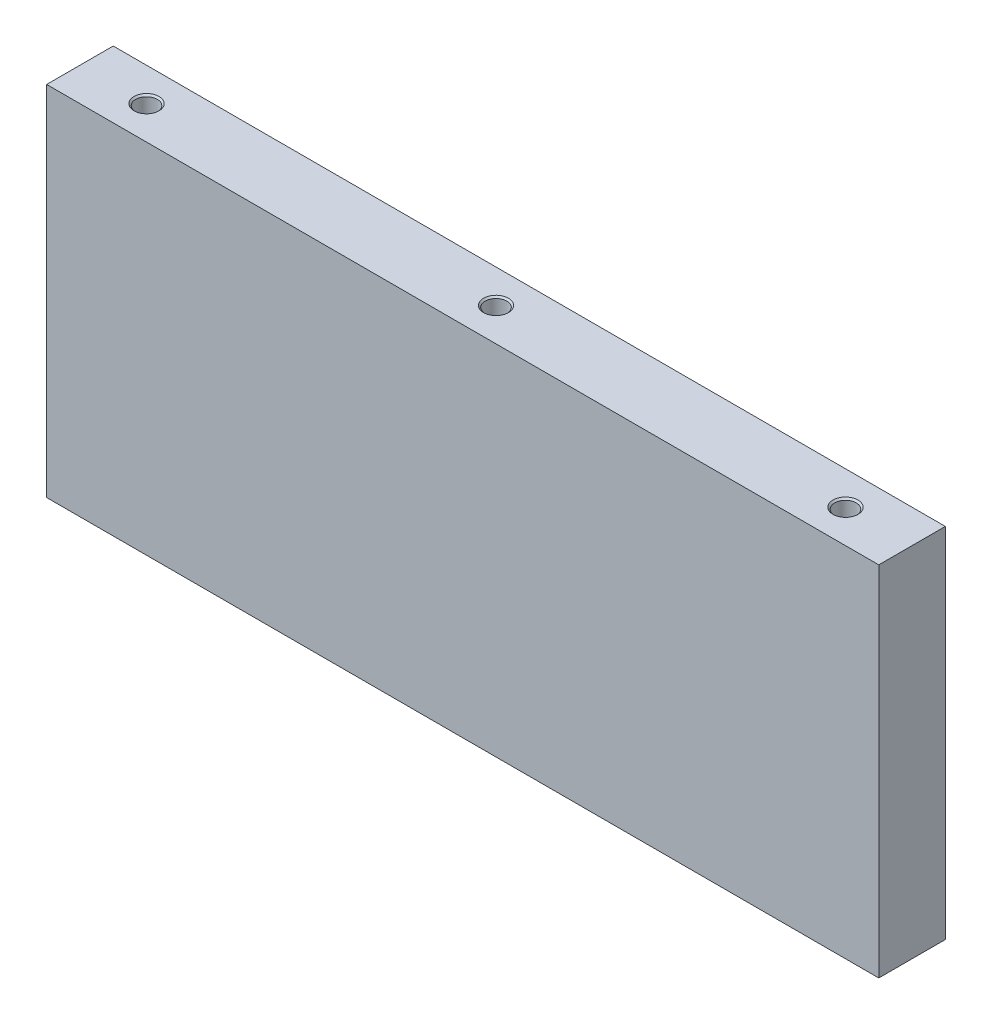
from build123d import *

# Parameters (mm, degrees)
SKETCH_1_W               = 100
SKETCH_1_H               = 43
EXTRUDE_1_DEPTH          = 8
SKETCH_2_R               = 1.3
CUT_EXTRUDE_1_DEPTH      = 8
PATTERN_LINEAR_1_COUNT   = 3
PATTERN_LINEAR_1_PITCH   = 42
MIRROR_1_COPY_1_SKETCH_R = 1.3
MIRROR_1_COPY_1_DEPTH    = 8
MIRROR_1_COPY_2_SKETCH_R = 1.3
MIRROR_1_COPY_2_DEPTH    = 8
CHAMFER_1_SIZE           = 0.2


with BuildPart() as part:
    # 草圖1 → 填料-伸長1 (new body)
    with BuildSketch(Plane.XY):
        Rectangle(SKETCH_1_W, SKETCH_1_H)
    extrude(amount=EXTRUDE_1_DEPTH)

    # 草圖2 → 除料-伸長1 (cut)
    with BuildSketch(Plane(origin=(0, 21.5, 0), x_dir=(1, 0, 0), z_dir=(0, 1, 0))):
        with Locations(Location((-42, -4, 0), (0, 0, 270))):
            Circle(SKETCH_2_R)
    cut_extrude_1 = extrude(amount=-CUT_EXTRUDE_1_DEPTH, mode=Mode.SUBTRACT)

    # 直線複製排列1: 除料-伸長1 ×3
    with Locations(*[(i * PATTERN_LINEAR_1_PITCH, 0, 0) for i in range(1, PATTERN_LINEAR_1_COUNT)]):
        add(cut_extrude_1, mode=Mode.SUBTRACT)

    # 鏡射1: 除料-伸長1 across plane
    add(cut_extrude_1.mirror(Plane.ZX), mode=Mode.SUBTRACT)

    # 鏡射1 copy 1 sketch → 鏡射1 copy 1 (cut)
    with BuildSketch(Plane(origin=(42, -21.5, 0), x_dir=(1, 0, 0), z_dir=(0, -1, 0))):
        with Locations((-42, 4)):
            Circle(MIRROR_1_COPY_1_SKETCH_R)
    extrude(amount=-MIRROR_1_COPY_1_DEPTH, mode=Mode.SUBTRACT)

    # 鏡射1 copy 2 sketch → 鏡射1 copy 2 (cut)
    with BuildSketch(Plane(origin=(84, -21.5, 0), x_dir=(1, 0, 0), z_dir=(0, -1, 0))):
        with Locations((-42, 4)):
            Circle(MIRROR_1_COPY_2_SKETCH_R)
    extrude(amount=-MIRROR_1_COPY_2_DEPTH, mode=Mode.SUBTRACT)

    # 導角1
    chamfer_1_edges = [part.edges().sort_by_distance(p)[0] for p in [
        (-42, 21.5, 2.7),
        (0, 21.5, 2.7),
        (42, 21.5, 2.7),
        (-42, -21.5, 2.7),
        (-1.3, -21.5, 4),
        (40.7, -21.5, 4),
    ]]
    chamfer(chamfer_1_edges, length=CHAMFER_1_SIZE)


solid = part.part
